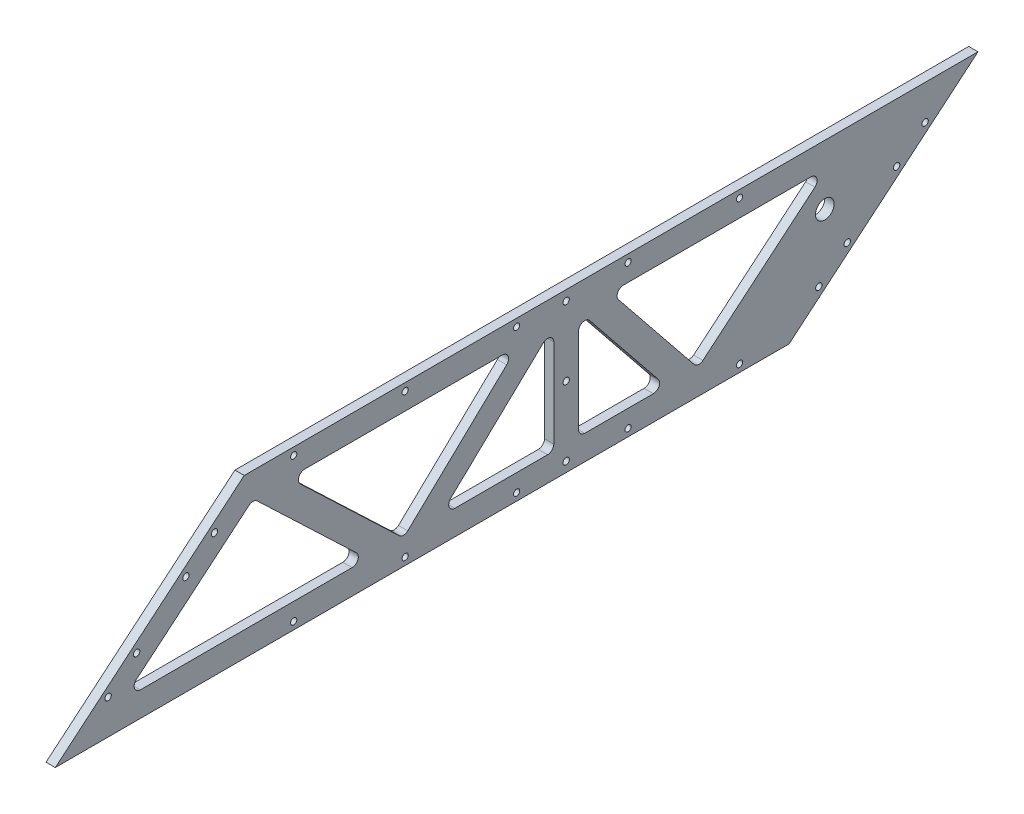
from build123d import *

# Parameters (mm, degrees)
BOSS_EXTRUDE1_DEPTH           = 4.7625
SKETCH2_R                     = 4.7625
GEARBOX_WITH_PRESS_FITS_DEPTH = 412.602247496
SKETCH3_R                     = 1.58115
CUT_EXTRUDE1_DEPTH            = 412.602247496
F_4_CLEARANCE_HOLE2_D         = 3.2639
F_4_CLEARANCE_HOLE2_DEPTH     = 28.702
F_4_CLEARANCE_HOLE2_TIP       = 0.980574487
F_4_CLEARANCE_HOLE1_D         = 3.2639
F_4_CLEARANCE_HOLE1_DEPTH     = 4.826
F_4_CLEARANCE_HOLE1_TIP       = 0.980574487
CUT_EXTRUDE2_DEPTH            = 412.602247496


with BuildPart() as part:
    # Sketch1 → Boss-Extrude1 (new body)
    with BuildSketch(Plane(origin=(0, 0, 0), x_dir=(0, 0, -1), z_dir=(1, 0, 0))):
        Polygon((33.297595377, -40.64), (312.697595377, -40.64), (345.995190754, -12.7), (409.563327383, 40.64), (312.697595377, 40.64), (33.297595377, 40.64), (0, 12.7), (-63.568136629, -40.64), align=None)
    extrude(amount=BOSS_EXTRUDE1_DEPTH)

    # Sketch2 → Gearbox (with Press fits) (cut, through all)
    with BuildSketch(Plane(origin=(4.7625, 0, 0), x_dir=(0, 0, -1), z_dir=(1, 0, 0))):
        with Locations((331.004197306, 10)):
            Circle(SKETCH2_R)
    extrude(amount=-GEARBOX_WITH_PRESS_FITS_DEPTH, mode=Mode.SUBTRACT)

    # Sketch3 → Cut-Extrude1 (cut, through all)
    with BuildSketch(Plane(origin=(4.7625, 0, 0), x_dir=(0, 0, -1), z_dir=(1, 0, 0))):
        with Locations((287.297595377, 36.83)):
            Circle(SKETCH3_R)
        with Locations((230.147595377, 36.83)):
            Circle(SKETCH3_R)
        with Locations((172.997595377, 36.83)):
            Circle(SKETCH3_R)
        with Locations((115.847595377, 36.83)):
            Circle(SKETCH3_R)
        with Locations((58.697595377, 36.83)):
            Circle(SKETCH3_R)
        with Locations((58.697595377, -36.83)):
            Circle(SKETCH3_R)
        with Locations((115.847595377, -36.83)):
            Circle(SKETCH3_R)
        with Locations((172.997595377, -36.83)):
            Circle(SKETCH3_R)
        with Locations((230.147595377, -36.83)):
            Circle(SKETCH3_R)
        with Locations((287.297595377, -36.83)):
            Circle(SKETCH3_R)
    extrude(amount=-CUT_EXTRUDE1_DEPTH, mode=Mode.SUBTRACT)

    # #4 Clearance Hole2
    with Locations(Plane(origin=(4.7625, 0, 0), x_dir=(0, 0, -1), z_dir=(1, 0, 0))):
        with Locations((327.962613202, -22.8575274), (342.555759844, -10.612423436), (367.850547356, 10.612423436), (382.443693997, 22.8575274), (18.032577552, 22.8575274), (3.43943091, 10.612423436), (-21.855356602, -10.612423436), (-36.448503243, -22.8575274)):
            Hole(F_4_CLEARANCE_HOLE2_D / 2, depth=F_4_CLEARANCE_HOLE2_DEPTH)
            with Locations((0, 0, -(F_4_CLEARANCE_HOLE2_DEPTH + F_4_CLEARANCE_HOLE2_TIP / 2))):  # 118° drill point
                Cone(0, F_4_CLEARANCE_HOLE2_D / 2, F_4_CLEARANCE_HOLE2_TIP, mode=Mode.SUBTRACT)

    # #4 Clearance Hole1
    with Locations(Plane(origin=(4.7625, 0, 0), x_dir=(0, 0, -1), z_dir=(1, 0, 0))):
        with Locations((198.397595377, 35.56), (198.397595377, -35.56), (198.397595377, 0)):
            Hole(F_4_CLEARANCE_HOLE1_D / 2, depth=F_4_CLEARANCE_HOLE1_DEPTH)
            with Locations((0, 0, -(F_4_CLEARANCE_HOLE1_DEPTH + F_4_CLEARANCE_HOLE1_TIP / 2))):  # 118° drill point
                Cone(0, F_4_CLEARANCE_HOLE1_D / 2, F_4_CLEARANCE_HOLE1_TIP, mode=Mode.SUBTRACT)

    # Sketch11 → Cut-Extrude2 (cut, through all)
    with BuildSketch(Plane(origin=(4.7625, 0, 0), x_dir=(0, 0, -1), z_dir=(1, 0, 0))):
        with BuildLine():
            Line((-21.992783256, -22.332808893), (35.744876514, 26.114840125))
            ThreePointArc((35.744876514, 26.114840125), (37.885826828, 26.856070682), (39.975806034, 25.981383362))
            Line((39.975806034, 25.981383362), (90.827068404, -22.466265655))
            ThreePointArc((90.827068404, -22.466265655), (91.584794367, -25.944437039), (88.636989544, -27.94))
            Line((88.636989544, -27.94), (-19.951932595, -27.94))
            ThreePointArc((-19.951932595, -27.94), (-22.935456666, -25.850913955), (-21.992783256, -22.332808893))
        make_face()
        with BuildLine():
            Line((62.076755313, 22.466265655), (112.793727505, -25.853440749))
            ThreePointArc((112.793727505, -25.853440749), (114.983806365, -26.729706404), (117.173885225, -25.853440749))
            Line((117.173885225, -25.853440749), (167.890857417, 22.466265655))
            ThreePointArc((167.890857417, 22.466265655), (168.648583379, 25.944437039), (165.700778557, 27.94))
            Line((165.700778557, 27.94), (64.266834173, 27.94))
            ThreePointArc((64.266834173, 27.94), (61.31902935, 25.944437039), (62.076755313, 22.466265655))
        make_face()
        with BuildLine():
            Line((186.682516517, 22.828515143), (139.140544325, -22.466265655))
            ThreePointArc((139.140544325, -22.466265655), (138.382818363, -25.944437039), (141.330623185, -27.94))
            Line((141.330623185, -27.94), (188.872595377, -27.94))
            ThreePointArc((188.872595377, -27.94), (191.117659407, -27.01006403), (192.047595377, -24.765))
            Line((192.047595377, -24.765), (192.047595377, 20.529780798))
            ThreePointArc((192.047595377, 20.529780798), (190.123020229, 23.448181506), (186.682516517, 22.828515143))
        make_face()
        with BuildLine():
            Line((204.747595377, 18.932195541), (204.747595377, -24.765))
            ThreePointArc((204.747595377, -24.765), (205.677531347, -27.01006403), (207.922595377, -27.94))
            Line((207.922595377, -27.94), (243.096578394, -27.94))
            ThreePointArc((243.096578394, -27.94), (245.960282851, -26.13606593), (245.569855632, -22.774139707))
            Line((245.569855632, -22.774139707), (210.395872614, 20.923055835))
            ThreePointArc((210.395872614, 20.923055835), (206.867140553, 21.926630398), (204.747595377, 18.932195541))
        make_face()
        with BuildLine():
            Line((225.209113147, 22.774139707), (263.999518653, -25.415794703))
            ThreePointArc((263.999518653, -25.415794703), (266.163859962, -26.584868521), (268.513646551, -25.857125516))
            Line((268.513646551, -25.857125516), (325.94417401, 22.332808893))
            ThreePointArc((325.94417401, 22.332808893), (326.88684742, 25.850913955), (323.903323349, 27.94))
            Line((323.903323349, 27.94), (227.682390385, 27.94))
            ThreePointArc((227.682390385, 27.94), (224.818685928, 26.13606593), (225.209113147, 22.774139707))
        make_face()
    extrude(amount=-CUT_EXTRUDE2_DEPTH, mode=Mode.SUBTRACT)


solid = part.part
